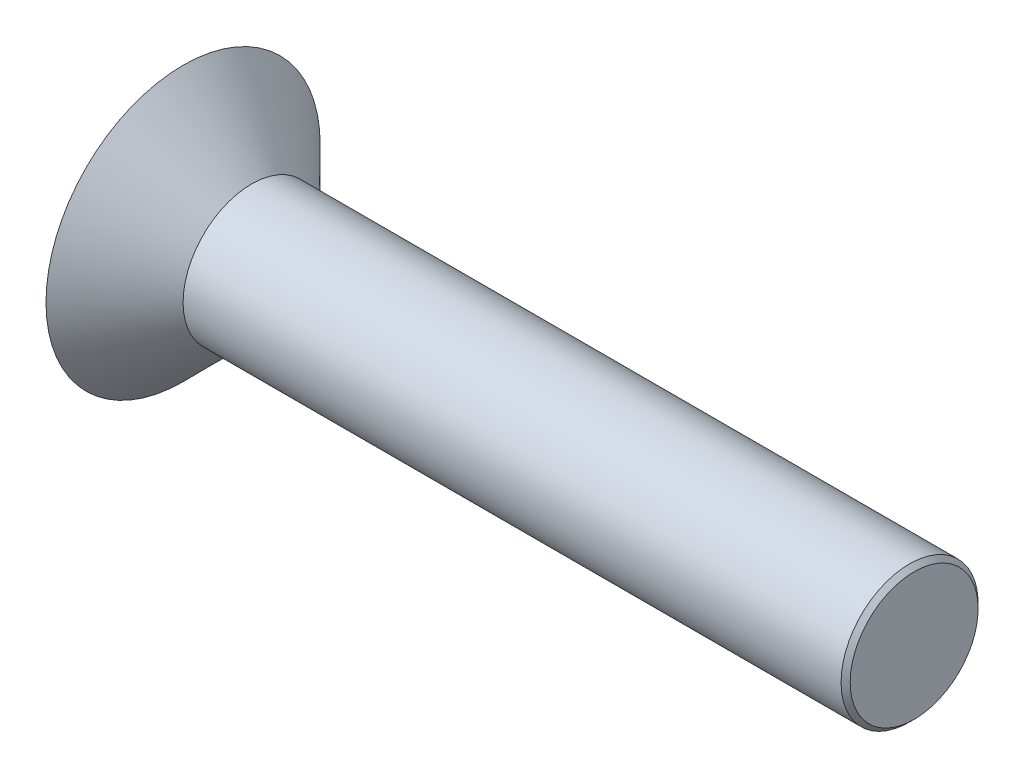
from build123d import *

# Parameters (mm, degrees)
CUT_EXTRUDE_541_DEPTH = 1.2
CHAMFER_598_SIZE      = 0.1


with BuildPart() as part:
    # 草图1 → Revolve 358 (revolve)
    with BuildSketch(Plane(origin=(0, 0, 0), x_dir=(1, 0, 0), z_dir=(0, 1, 0)), mode=Mode.PRIVATE) as revolve_358_sk:
        Polygon((0, 0), (0, 3), (1.5, 1.5), (16, 1.5), (16, 0), align=None)
    revolve(revolve_358_sk.sketch.rotate(Axis((0, 0, 0), (1, 0, 0)), 180), axis=Axis((0, 0, 0), (1, 0, 0)))

    # 草图2 → Cut-Extrude 541 (cut)
    with BuildSketch(Plane.ZY):
        Polygon((1.443375673, 0), (0.721687836, 1.25), (-0.721687836, 1.25), (-1.443375673, 0), (-0.721687836, -1.25), (0.721687836, -1.25), align=None)
    extrude(amount=-CUT_EXTRUDE_541_DEPTH, mode=Mode.SUBTRACT)

    # Chamfer 598
    chamfer_598_edges = [part.edges().sort_by_distance(p)[0] for p in [
        (16, 0, -1.5),
    ]]
    chamfer(chamfer_598_edges, length=CHAMFER_598_SIZE)


solid = part.part
